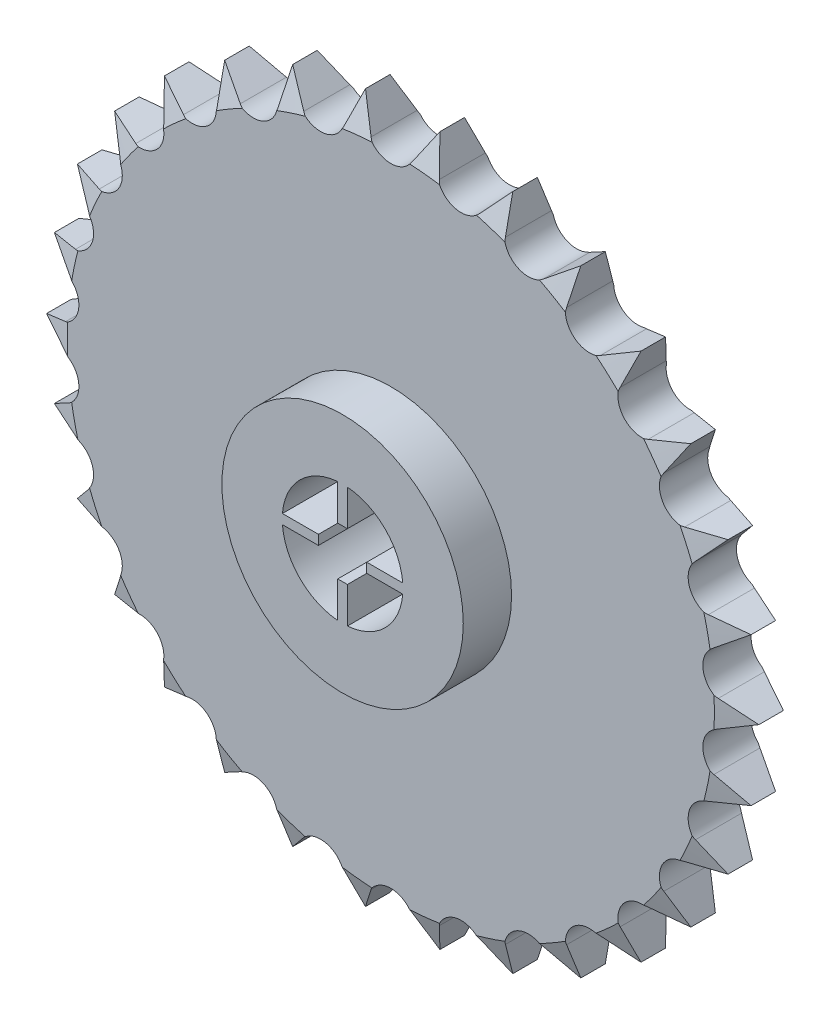
from build123d import *

# Parameters (mm, degrees)
IZIM1_R                     = 75
IZIM1_R_2                   = 25
Y_KSEKLIK_EKSTR_ZYON4_DEPTH = 10
KES_EKSTR_ZYON1_DEPTH       = 10
DAIRESEL_KAPLAMA1_COUNT     = 30
Y_KSEKLIK_EKSTR_ZYON5_START = -5
IZIM9_R                     = 25
IZIM9_R_2                   = 12.5
Y_KSEKLIK_EKSTR_ZYON5_DEPTH = 15
Y_KSEKLIK_EKSTR_ZYON6_START = -30
Y_KSEKLIK_EKSTR_ZYON6_DEPTH = 30


with BuildPart() as part:
    # Çizim1 → Yükseklik-Ekstrüzyon4 (new body)
    with BuildSketch(Plane.XY):
        Circle(IZIM1_R)
        Circle(IZIM1_R_2, mode=Mode.SUBTRACT)
    extrude(amount=-Y_KSEKLIK_EKSTR_ZYON4_DEPTH)

    # Çizim3 → Kes-Ekstrüzyon1 (cut)
    with BuildSketch(Plane.XY):
        with BuildLine():
            Line((-4.330127019, 67.5), (-9.042607583, 75.662255766))
            Line((-9.042607583, 75.662255766), (9.042607583, 75.662255766))
            Line((9.042607583, 75.662255766), (4.330127019, 67.5))
            ThreePointArc((4.330127019, 67.5), (0, 65), (-4.330127019, 67.5))
        make_face()
    kes_ekstr_zyon1 = extrude(amount=-KES_EKSTR_ZYON1_DEPTH, mode=Mode.SUBTRACT)

    # Dairesel Kaplama1: Kes-Ekstrüzyon1 ×30 about axis
    dairesel_kaplama1_axis = Axis((0, 0, 0), (0, 0, 1))
    for i in range(1, DAIRESEL_KAPLAMA1_COUNT):
        add(kes_ekstr_zyon1.rotate(dairesel_kaplama1_axis, i * 360 / DAIRESEL_KAPLAMA1_COUNT), mode=Mode.SUBTRACT)

    # Çizim7 → Kes-Döndür2 (revolve, cut)
    with BuildSketch(Plane(origin=(0, 0, 0), x_dir=(0, 0, -1), z_dir=(1, 0, 0))):
        Polygon((0, 67), (2.911761874, 75), (0, 75), align=None)
        Polygon((10, 67), (10, 75), (7.088238126, 75), align=None)
    revolve(axis=Axis((0, 0, 0), (0, 0, -1)), mode=Mode.SUBTRACT)

    # Çizim9 → Yükseklik-Ekstrüzyon5 (add, symmetric)
    with BuildSketch(Plane.XY.offset(Y_KSEKLIK_EKSTR_ZYON5_START)):
        Circle(IZIM9_R)
        Circle(IZIM9_R_2, mode=Mode.SUBTRACT)
    extrude(amount=Y_KSEKLIK_EKSTR_ZYON5_DEPTH, both=True)

    # Çizim10 → Yükseklik-Ekstrüzyon6 (add)
    with BuildSketch(Plane.XY.offset(10).offset(Y_KSEKLIK_EKSTR_ZYON6_START)):
        with BuildLine():
            Line((-12.459935794, 1), (-5, 1))
            Line((-5, 1), (-5, -1))
            Line((-5, -1), (-12.459935794, -1))
            ThreePointArc((-12.459935794, -1), (-12.5, 0), (-12.459935794, 1))
        make_face()
        with BuildLine():
            Line((1, 12.459935794), (1, 5))
            Line((1, 5), (-1, 5))
            Line((-1, 5), (-1, 12.459935794))
            ThreePointArc((-1, 12.459935794), (0, 12.5), (1, 12.459935794))
        make_face()
        with BuildLine():
            Line((-1, -5), (-1, -12.459935794))
            ThreePointArc((-1, -12.459935794), (0, -12.5), (1, -12.459935794))
            Line((1, -12.459935794), (1, -5))
            Line((1, -5), (-1, -5))
        make_face()
        with BuildLine():
            Line((5, 1), (12.459935794, 1))
            ThreePointArc((12.459935794, 1), (12.5, 0), (12.459935794, -1))
            Line((12.459935794, -1), (5, -1))
            Line((5, -1), (5, 1))
        make_face()
    extrude(amount=Y_KSEKLIK_EKSTR_ZYON6_DEPTH)


solid = part.part
